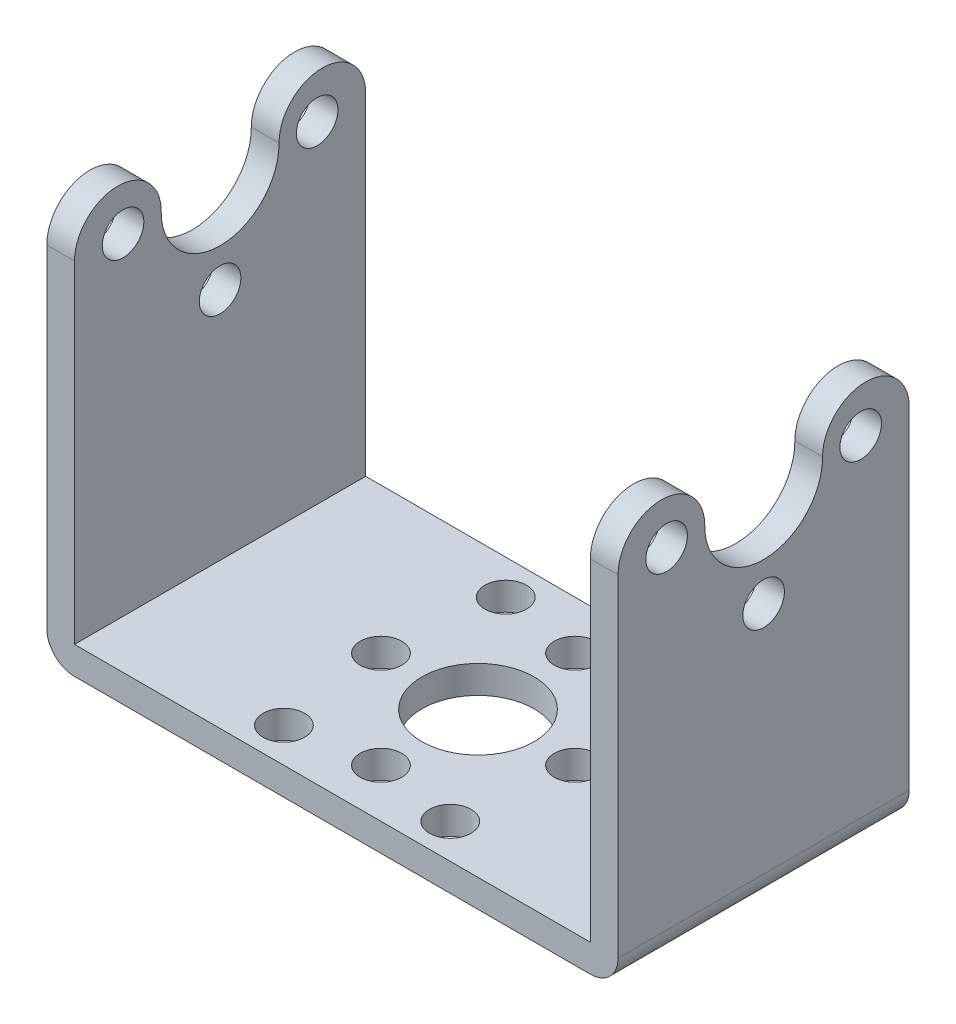
from build123d import *

# Parameters (mm, degrees)
SKETCH1_W           = 41.2
SKETCH1_H           = 21
SKETCH1_R           = 4.05
SKETCH1_R_2         = 1.5
BOSS_EXTRUDE1_DEPTH = 2
SKETCH2_W           = 2
SKETCH2_H           = 21
BOSS_EXTRUDE2_DEPTH = 28.2
SKETCH3_R           = 1.5
SKETCH3_R_2         = 4.25
CUT_EXTRUDE1_DEPTH  = 53.151030671
CUT_EXTRUDE2_DEPTH  = 53.151030671
FILLET1_R           = 2


with BuildPart() as part:
    # Sketch1 → Boss-Extrude1 (new body)
    with BuildSketch(Plane(origin=(0, 0, 0), x_dir=(1, 0, 0), z_dir=(0, 1, 0))):
        Rectangle(SKETCH1_W, SKETCH1_H)
        with Locations(Location((0, 0, 0), (0, 0, 270))):
            Circle(SKETCH1_R, mode=Mode.SUBTRACT)
        with Locations(Location((0, 7, 0), (0, 0, 270))):
            Circle(SKETCH1_R_2, mode=Mode.SUBTRACT)
        with Locations(Location((7, 0, 0), (0, 0, 270))):
            Circle(SKETCH1_R_2, mode=Mode.SUBTRACT)
        with Locations(Location((0, -7, 0), (0, 0, 270))):
            Circle(SKETCH1_R_2, mode=Mode.SUBTRACT)
        with Locations(Location((-7, 0, 0), (0, 0, 270))):
            Circle(SKETCH1_R_2, mode=Mode.SUBTRACT)
        with Locations(Location((6, -8, 0), (0, 0, 270))):
            Circle(SKETCH1_R_2, mode=Mode.SUBTRACT)
        with Locations(Location((6, 8, 0), (0, 0, 270))):
            Circle(SKETCH1_R_2, mode=Mode.SUBTRACT)
        with Locations(Location((-6, 8, 0), (0, 0, 270))):
            Circle(SKETCH1_R_2, mode=Mode.SUBTRACT)
        with Locations(Location((-6, -8, 0), (0, 0, 270))):
            Circle(SKETCH1_R_2, mode=Mode.SUBTRACT)
    extrude(amount=BOSS_EXTRUDE1_DEPTH)

    # Sketch2 → Boss-Extrude2 (add)
    with BuildSketch(Plane(origin=(0, 2, 0), x_dir=(1, 0, 0), z_dir=(0, 1, 0))):
        with Locations((-19.6, 0)):
            Rectangle(SKETCH2_W, SKETCH2_H)
        with Locations((19.6, 0)):
            Rectangle(SKETCH2_W, SKETCH2_H)
    extrude(amount=BOSS_EXTRUDE2_DEPTH)

    # Sketch3 → Cut-Extrude1 (cut, through all)
    with BuildSketch(Plane.ZY.offset(20.6)):
        with Locations((-7, 25.9)):
            Circle(SKETCH3_R)
        with Locations((0, 18.9)):
            Circle(SKETCH3_R)
        with Locations((7, 25.9)):
            Circle(SKETCH3_R)
        with Locations((0, 25.9)):
            Circle(SKETCH3_R_2)
    extrude(amount=-CUT_EXTRUDE1_DEPTH, mode=Mode.SUBTRACT)

    # Sketch4 → Cut-Extrude2 (cut, through all)
    with BuildSketch(Plane.ZY.offset(20.6)):
        with BuildLine():
            Line((-10.5, 25.944077053), (-10.5, 30.2))
            Line((-10.5, 30.2), (10.5, 30.2))
            Line((10.5, 30.2), (10.5, 25.944076968))
            ThreePointArc((10.5, 25.944076968), (7.374885716, 29.069191252), (4.249771432, 25.944076968))
            ThreePointArc((4.249771432, 25.944076968), (0, 21.69430542), (-4.249771432, 25.944076968))
            ThreePointArc((-4.249771432, 25.944076968), (-7.374885673, 29.069191338), (-10.5, 25.944077053))
        make_face()
    extrude(amount=-CUT_EXTRUDE2_DEPTH, mode=Mode.SUBTRACT)

    # Fillet1
    fillet1_edges = [part.edges().sort_by_distance(p)[0] for p in [
        (20.6, 0, 0),
        (-20.6, 0, 0),
    ]]
    fillet(fillet1_edges, radius=FILLET1_R)


solid = part.part
